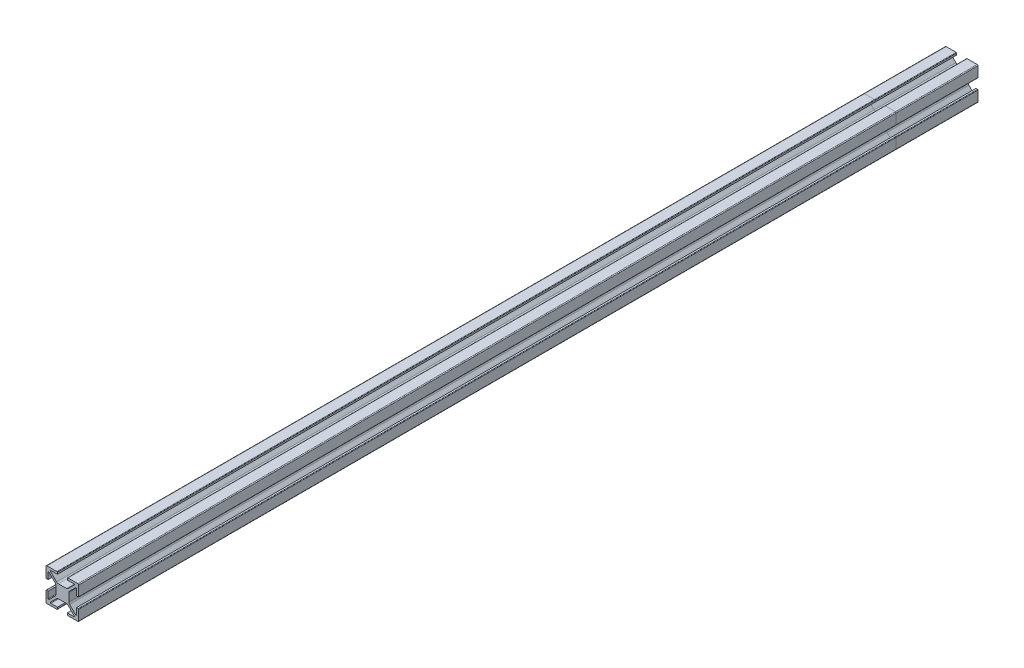
from build123d import *

# Parameters (mm, degrees)
ESBO_O11_R                                   = 2.25
QUADRADO_PF20_21_PERFIL_2020_T_SLOT_6M_DEPTH = 50
SALIENTE_EXTRUIR1_DEPTH                      = 500


with BuildPart() as part:
    # Esboço11 → Quadrado PF20-21 - PERFIL 2020 T-SLOT 6MM(1) (new body)
    with BuildSketch(Plane(origin=(0, 0, 0), x_dir=(0, -1, 0), z_dir=(0, 0, 1))):
        with BuildLine():
            Line((8.187867966, -7.26862915), (4.439339828, -3.520101013))
            ThreePointArc((4.439339828, -3.520101013), (4.114180701, -3.033465989), (4, -2.459440841))
            Line((4, -2.459440841), (4, 2.459440841))
            ThreePointArc((4, 2.459440841), (4.114180701, 3.033465989), (4.439339828, 3.520101013))
            Line((4.439339828, 3.520101013), (8.187867966, 7.26862915))
            ThreePointArc((8.187867966, 7.26862915), (8.51480503, 7.333660975), (8.7, 7.056497116))
            Line((8.7, 7.056497116), (8.7, 3.05))
            Line((8.7, 3.05), (9.7, 3.05))
            ThreePointArc((9.7, 3.05), (9.912132034, 3.137867966), (10, 3.35))
            Line((10, 3.35), (10, 9.5))
            ThreePointArc((10, 9.5), (9.853553391, 9.853553391), (9.5, 10))
            Line((9.5, 10), (3.35, 10))
            ThreePointArc((3.35, 10), (3.137867966, 9.912132034), (3.05, 9.7))
            Line((3.05, 9.7), (3.05, 8.7))
            Line((3.05, 8.7), (7.056497116, 8.7))
            ThreePointArc((7.056497116, 8.7), (7.333660975, 8.51480503), (7.26862915, 8.187867966))
            Line((7.26862915, 8.187867966), (3.520101013, 4.439339828))
            ThreePointArc((3.520101013, 4.439339828), (3.033465989, 4.114180701), (2.459440841, 4))
            Line((2.459440841, 4), (-2.459440841, 4))
            ThreePointArc((-2.459440841, 4), (-3.033465989, 4.114180701), (-3.520101013, 4.439339828))
            Line((-3.520101013, 4.439339828), (-7.26862915, 8.187867966))
            ThreePointArc((-7.26862915, 8.187867966), (-7.333660975, 8.51480503), (-7.056497116, 8.7))
            Line((-7.056497116, 8.7), (-3.05, 8.7))
            Line((-3.05, 8.7), (-3.05, 9.7))
            ThreePointArc((-3.05, 9.7), (-3.137867966, 9.912132034), (-3.35, 10))
            Line((-3.35, 10), (-9.5, 10))
            ThreePointArc((-9.5, 10), (-9.853553391, 9.853553391), (-10, 9.5))
            Line((-10, 9.5), (-10, 3.35))
            ThreePointArc((-10, 3.35), (-9.912132034, 3.137867966), (-9.7, 3.05))
            Line((-9.7, 3.05), (-8.7, 3.05))
            Line((-8.7, 3.05), (-8.7, 7.056497116))
            ThreePointArc((-8.7, 7.056497116), (-8.51480503, 7.333660975), (-8.187867966, 7.26862915))
            Line((-8.187867966, 7.26862915), (-4.439339828, 3.520101013))
            ThreePointArc((-4.439339828, 3.520101013), (-4.114180701, 3.033465989), (-4, 2.459440841))
            Line((-4, 2.459440841), (-4, -2.459440841))
            ThreePointArc((-4, -2.459440841), (-4.114180701, -3.033465989), (-4.439339828, -3.520101013))
            Line((-4.439339828, -3.520101013), (-8.187867966, -7.26862915))
            ThreePointArc((-8.187867966, -7.26862915), (-8.51480503, -7.333660975), (-8.7, -7.056497116))
            Line((-8.7, -7.056497116), (-8.7, -3.05))
            Line((-8.7, -3.05), (-9.7, -3.05))
            ThreePointArc((-9.7, -3.05), (-9.912132034, -3.137867966), (-10, -3.35))
            Line((-10, -3.35), (-10, -9.5))
            ThreePointArc((-10, -9.5), (-9.853553391, -9.853553391), (-9.5, -10))
            Line((-9.5, -10), (-3.35, -10))
            ThreePointArc((-3.35, -10), (-3.137867966, -9.912132034), (-3.05, -9.7))
            Line((-3.05, -9.7), (-3.05, -8.7))
            Line((-3.05, -8.7), (-7.056497116, -8.7))
            ThreePointArc((-7.056497116, -8.7), (-7.333660975, -8.51480503), (-7.26862915, -8.187867966))
            Line((-7.26862915, -8.187867966), (-3.520101013, -4.439339828))
            ThreePointArc((-3.520101013, -4.439339828), (-3.033465989, -4.114180701), (-2.459440841, -4))
            Line((-2.459440841, -4), (2.459440841, -4))
            ThreePointArc((2.459440841, -4), (3.033465989, -4.114180701), (3.520101013, -4.439339828))
            Line((3.520101013, -4.439339828), (7.26862915, -8.187867966))
            ThreePointArc((7.26862915, -8.187867966), (7.333660975, -8.51480503), (7.056497116, -8.7))
            Line((7.056497116, -8.7), (3.05, -8.7))
            Line((3.05, -8.7), (3.05, -9.7))
            ThreePointArc((3.05, -9.7), (3.137867966, -9.912132034), (3.35, -10))
            Line((3.35, -10), (9.5, -10))
            ThreePointArc((9.5, -10), (9.853553391, -9.853553391), (10, -9.5))
            Line((10, -9.5), (10, -3.35))
            ThreePointArc((10, -3.35), (9.912132034, -3.137867966), (9.7, -3.05))
            Line((9.7, -3.05), (8.7, -3.05))
            Line((8.7, -3.05), (8.7, -7.056497116))
            ThreePointArc((8.7, -7.056497116), (8.51480503, -7.333660975), (8.187867966, -7.26862915))
        make_face()
        Circle(ESBO_O11_R, mode=Mode.SUBTRACT)
    extrude(amount=QUADRADO_PF20_21_PERFIL_2020_T_SLOT_6M_DEPTH)


with BuildPart() as body_2:
    # Croquis1 → Saliente-Extruir1 (new body)
    with BuildSketch(Plane.XY.offset(50)):
        with BuildLine():
            Line((-7.26862915, -8.187867966), (-3.520101013, -4.439339828))
            ThreePointArc((-3.520101013, -4.439339828), (-3.033465989, -4.114180701), (-2.459440841, -4))
            Line((-2.459440841, -4), (2.459440841, -4))
            ThreePointArc((2.459440841, -4), (3.033465989, -4.114180701), (3.520101013, -4.439339828))
            Line((3.520101013, -4.439339828), (7.26862915, -8.187867966))
            ThreePointArc((7.26862915, -8.187867966), (7.333660975, -8.51480503), (7.056497116, -8.7))
            Line((7.056497116, -8.7), (3.05, -8.7))
            Line((3.05, -8.7), (3.05, -9.7))
            ThreePointArc((3.05, -9.7), (3.137867966, -9.912132034), (3.35, -10))
            Line((3.35, -10), (9.5, -10))
            ThreePointArc((9.5, -10), (9.853553391, -9.853553391), (10, -9.5))
            Line((10, -9.5), (10, -3.35))
            ThreePointArc((10, -3.35), (9.912132034, -3.137867966), (9.7, -3.05))
            Line((9.7, -3.05), (8.7, -3.05))
            Line((8.7, -3.05), (8.7, -7.056497116))
            ThreePointArc((8.7, -7.056497116), (8.51480503, -7.333660975), (8.187867966, -7.26862915))
            Line((8.187867966, -7.26862915), (4.439339828, -3.520101013))
            ThreePointArc((4.439339828, -3.520101013), (4.114180701, -3.033465989), (4, -2.459440841))
            Line((4, -2.459440841), (4, 2.459440841))
            ThreePointArc((4, 2.459440841), (4.114180701, 3.033465989), (4.439339828, 3.520101013))
            Line((4.439339828, 3.520101013), (8.187867966, 7.26862915))
            ThreePointArc((8.187867966, 7.26862915), (8.51480503, 7.333660975), (8.7, 7.056497116))
            Line((8.7, 7.056497116), (8.7, 3.05))
            Line((8.7, 3.05), (9.7, 3.05))
            ThreePointArc((9.7, 3.05), (9.912132034, 3.137867966), (10, 3.35))
            Line((10, 3.35), (10, 9.5))
            ThreePointArc((10, 9.5), (9.853553391, 9.853553391), (9.5, 10))
            Line((9.5, 10), (3.35, 10))
            ThreePointArc((3.35, 10), (3.137867966, 9.912132034), (3.05, 9.7))
            Line((3.05, 9.7), (3.05, 8.7))
            Line((3.05, 8.7), (7.056497116, 8.7))
            ThreePointArc((7.056497116, 8.7), (7.333660975, 8.51480503), (7.26862915, 8.187867966))
            Line((7.26862915, 8.187867966), (3.520101013, 4.439339828))
            ThreePointArc((3.520101013, 4.439339828), (3.033465989, 4.114180701), (2.459440841, 4))
            Line((2.459440841, 4), (-2.459440841, 4))
            ThreePointArc((-2.459440841, 4), (-3.033465989, 4.114180701), (-3.520101013, 4.439339828))
            Line((-3.520101013, 4.439339828), (-7.26862915, 8.187867966))
            ThreePointArc((-7.26862915, 8.187867966), (-7.333660975, 8.51480503), (-7.056497116, 8.7))
            Line((-7.056497116, 8.7), (-3.05, 8.7))
            Line((-3.05, 8.7), (-3.05, 9.7))
            ThreePointArc((-3.05, 9.7), (-3.137867966, 9.912132034), (-3.35, 10))
            Line((-3.35, 10), (-9.5, 10))
            ThreePointArc((-9.5, 10), (-9.853553391, 9.853553391), (-10, 9.5))
            Line((-10, 9.5), (-10, 3.35))
            ThreePointArc((-10, 3.35), (-9.912132034, 3.137867966), (-9.7, 3.05))
            Line((-9.7, 3.05), (-8.7, 3.05))
            Line((-8.7, 3.05), (-8.7, 7.056497116))
            ThreePointArc((-8.7, 7.056497116), (-8.51480503, 7.333660975), (-8.187867966, 7.26862915))
            Line((-8.187867966, 7.26862915), (-4.439339828, 3.520101013))
            ThreePointArc((-4.439339828, 3.520101013), (-4.114180701, 3.033465989), (-4, 2.459440841))
            Line((-4, 2.459440841), (-4, -2.459440841))
            ThreePointArc((-4, -2.459440841), (-4.114180701, -3.033465989), (-4.439339828, -3.520101013))
            Line((-4.439339828, -3.520101013), (-8.187867966, -7.26862915))
            ThreePointArc((-8.187867966, -7.26862915), (-8.51480503, -7.333660975), (-8.7, -7.056497116))
            Line((-8.7, -7.056497116), (-8.7, -3.05))
            Line((-8.7, -3.05), (-9.7, -3.05))
            ThreePointArc((-9.7, -3.05), (-9.912132034, -3.137867966), (-10, -3.35))
            Line((-10, -3.35), (-10, -9.5))
            ThreePointArc((-10, -9.5), (-9.853553391, -9.853553391), (-9.5, -10))
            Line((-9.5, -10), (-3.35, -10))
            ThreePointArc((-3.35, -10), (-3.137867966, -9.912132034), (-3.05, -9.7))
            Line((-3.05, -9.7), (-3.05, -8.7))
            Line((-3.05, -8.7), (-7.056497116, -8.7))
            ThreePointArc((-7.056497116, -8.7), (-7.333660975, -8.51480503), (-7.26862915, -8.187867966))
        make_face()
    extrude(amount=SALIENTE_EXTRUIR1_DEPTH)


solid = Compound([part.part, body_2.part])
